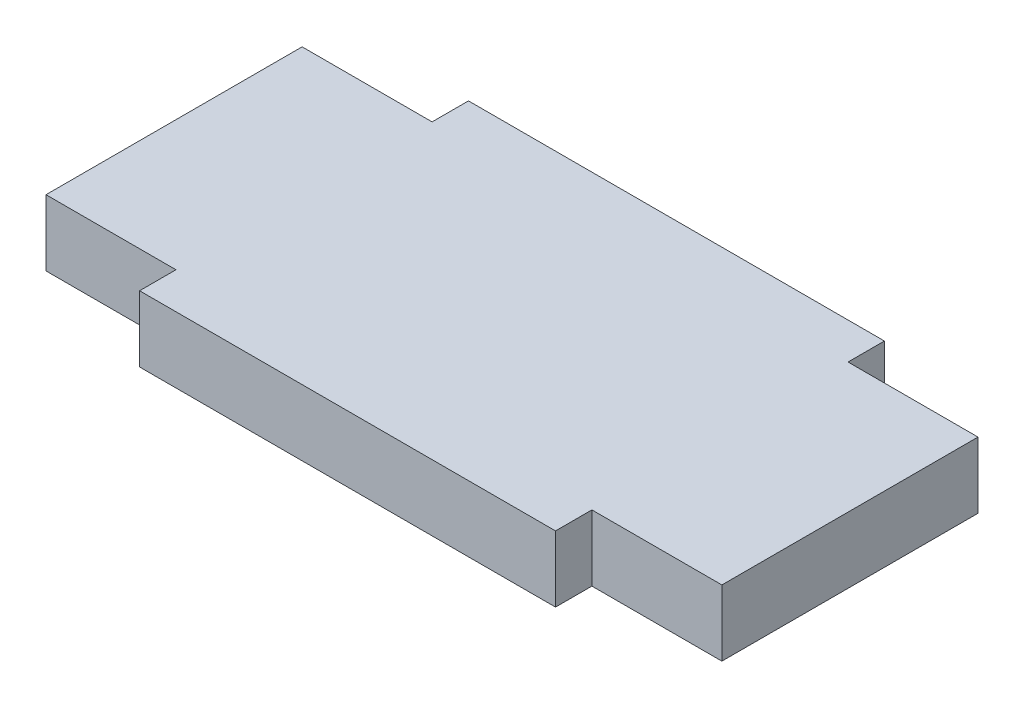
from build123d import *

# Parameters (mm, degrees)
BOSS_EXTRUDE1_DEPTH = 6.35


with BuildPart() as part:
    # Sketch1 → Boss-Extrude1 (new body)
    with BuildSketch(Plane(origin=(0, 0, 0), x_dir=(1, 0, 0), z_dir=(0, 1, 0))):
        Polygon((20.5, 20.645), (-19.5, 20.645), (-19.5, 17.145), (-32, 17.145), (-32, -7.485), (-19.5, -7.485), (-19.5, -10.985), (20.5, -10.985), (20.5, -7.485), (33, -7.485), (33, 17.145), (20.5, 17.145), align=None)
    extrude(amount=BOSS_EXTRUDE1_DEPTH)


solid = part.part
